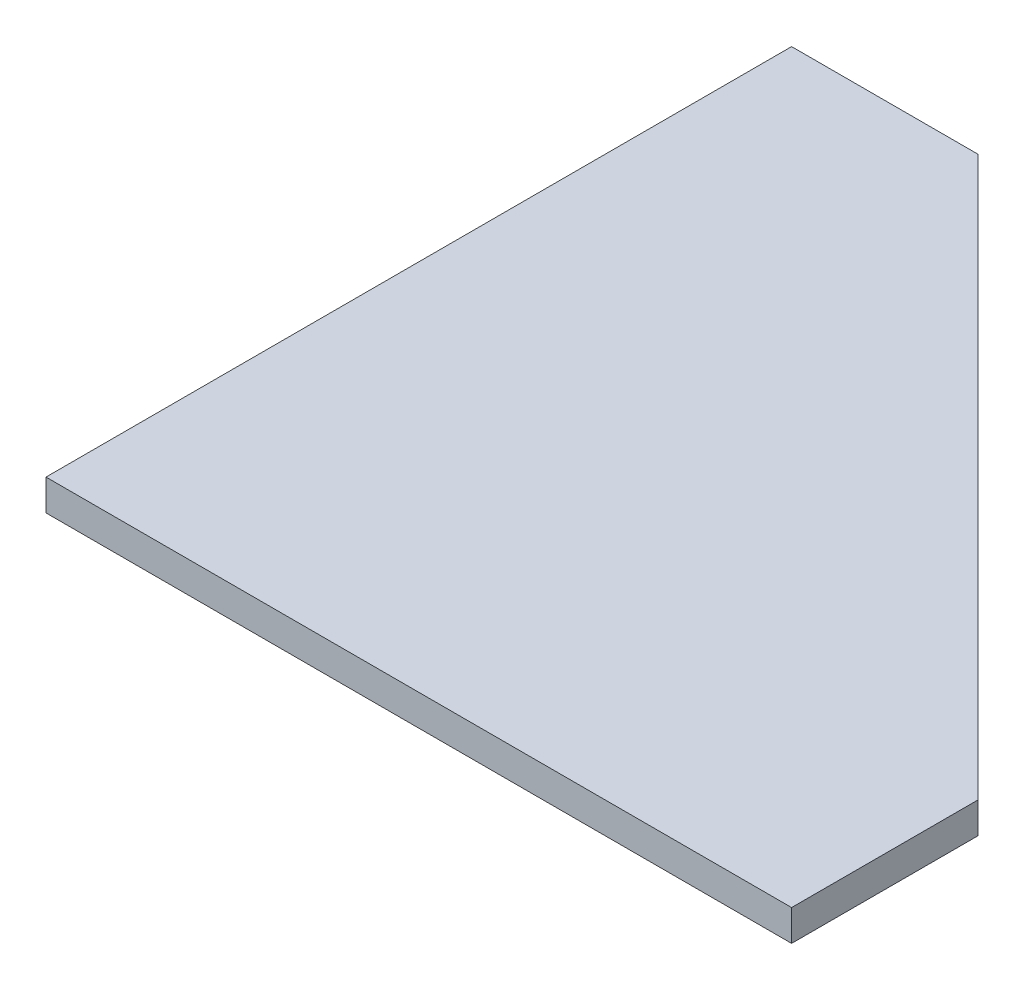
from build123d import *

# Parameters (mm, degrees)
EXTRUDE1_DEPTH = 6.35


with BuildPart() as part:
    # Sketch1 → Extrude1 (new body)
    with BuildSketch(Plane(origin=(0, 0, 0), x_dir=(1, 0, 0), z_dir=(0, 1, 0))):
        Polygon((0, 0), (0, 152.4), (38.1, 152.4), (152.4, 38.1), (152.4, 0), align=None)
    extrude(amount=EXTRUDE1_DEPTH)


solid = part.part
